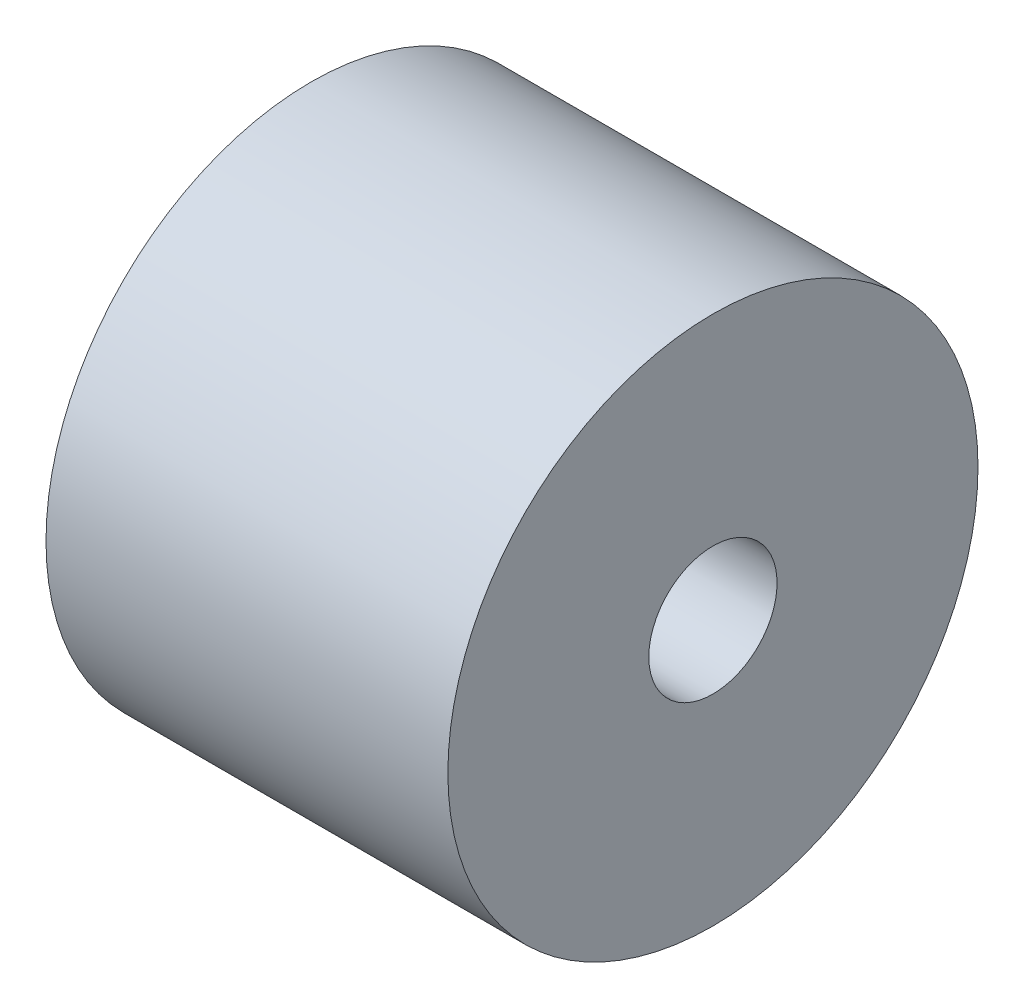
from build123d import *

# Parameters (mm, degrees)
ESQUISSE1_R             = 6.2
BOSS_EXTRU_2_DEPTH      = 9.4
ESQUISSE8_R             = 1.5
ENL_V_MAT_EXTRU_1_DEPTH = 13.854571171


with BuildPart() as part:
    # Esquisse1 → Boss.-Extru.2 (new body)
    with BuildSketch(Plane(origin=(0, 0, 0), x_dir=(0, 0, -1), z_dir=(1, 0, 0))):
        Circle(ESQUISSE1_R)
    extrude(amount=BOSS_EXTRU_2_DEPTH)

    # Esquisse8 → Enlèv. mat.-Extru.1 (cut, through all)
    with BuildSketch(Plane.ZY):
        Circle(ESQUISSE8_R)
    extrude(amount=-ENL_V_MAT_EXTRU_1_DEPTH, mode=Mode.SUBTRACT)


solid = part.part
